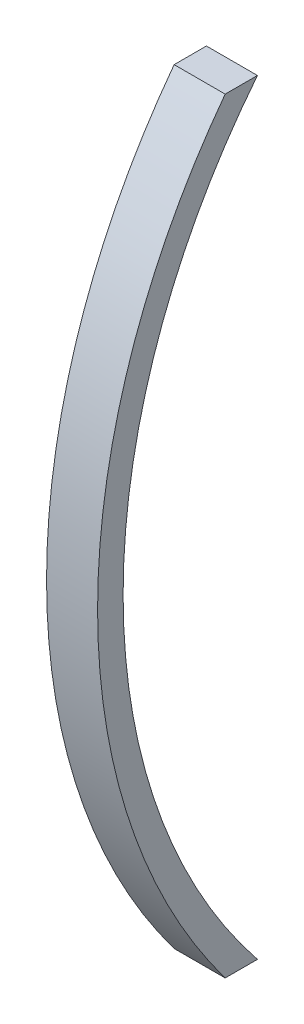
from build123d import *

# Parameters (mm, degrees)
BOSS_EXTRUDE1_DEPTH = 10


with BuildPart() as part:
    # Sketch1 → Boss-Extrude1 (new body)
    with BuildSketch(Plane(origin=(0, 0, 0), x_dir=(0, 0, -1), z_dir=(1, 0, 0))):
        with BuildLine():
            Line((-100, 75), (-93.674969976, 75))
            ThreePointArc((-93.674969976, 75), (-120, 0), (-93.674969976, -75))
            Line((-93.674969976, -75), (-100, -75))
            ThreePointArc((-100, -75), (-125, 0), (-100, 75))
        make_face()
    extrude(amount=BOSS_EXTRUDE1_DEPTH)


solid = part.part
